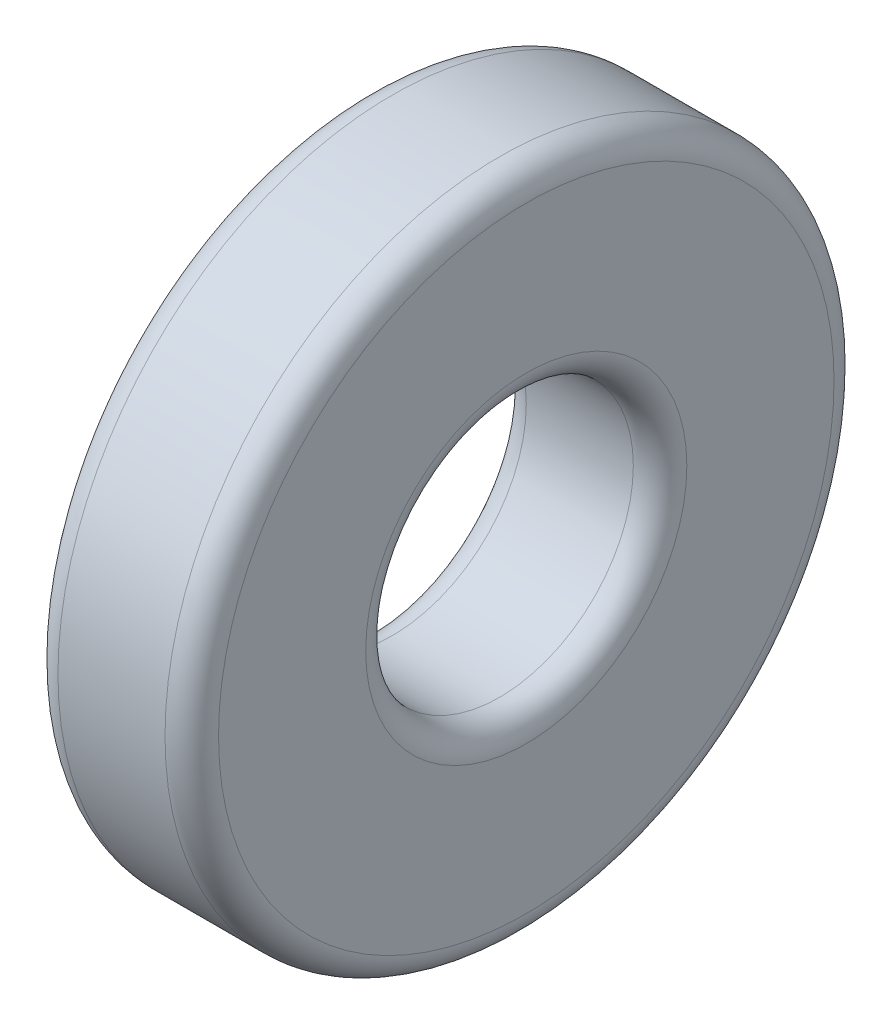
from build123d import *


with BuildPart() as part:
    # Sketch1 → Revolve1 (revolve)
    with BuildSketch(Plane(origin=(0, 0, 0), x_dir=(-1, 0, 0), z_dir=(0, 1, 0)), mode=Mode.PRIVATE) as revolve1_sk:
        with BuildLine():
            Line((2, 12.5), (-2, 12.5))
            ThreePointArc((-2, 12.5), (-2.707106781, 12.207106781), (-3, 11.5))
            Line((-3, 11.5), (-3, 6))
            ThreePointArc((-3, 6), (-2.707106781, 5.292893219), (-2, 5))
            Line((-2, 5), (2, 5))
            ThreePointArc((2, 5), (2.707106781, 5.292893219), (3, 6))
            Line((3, 6), (3, 11.5))
            ThreePointArc((3, 11.5), (2.707106781, 12.207106781), (2, 12.5))
        make_face()
    revolve(revolve1_sk.sketch.rotate(Axis((-3.111111111, 0, 0), (-1, 0, 0)), 180), axis=Axis((-3.111111111, 0, 0), (-1, 0, 0)))


solid = part.part
